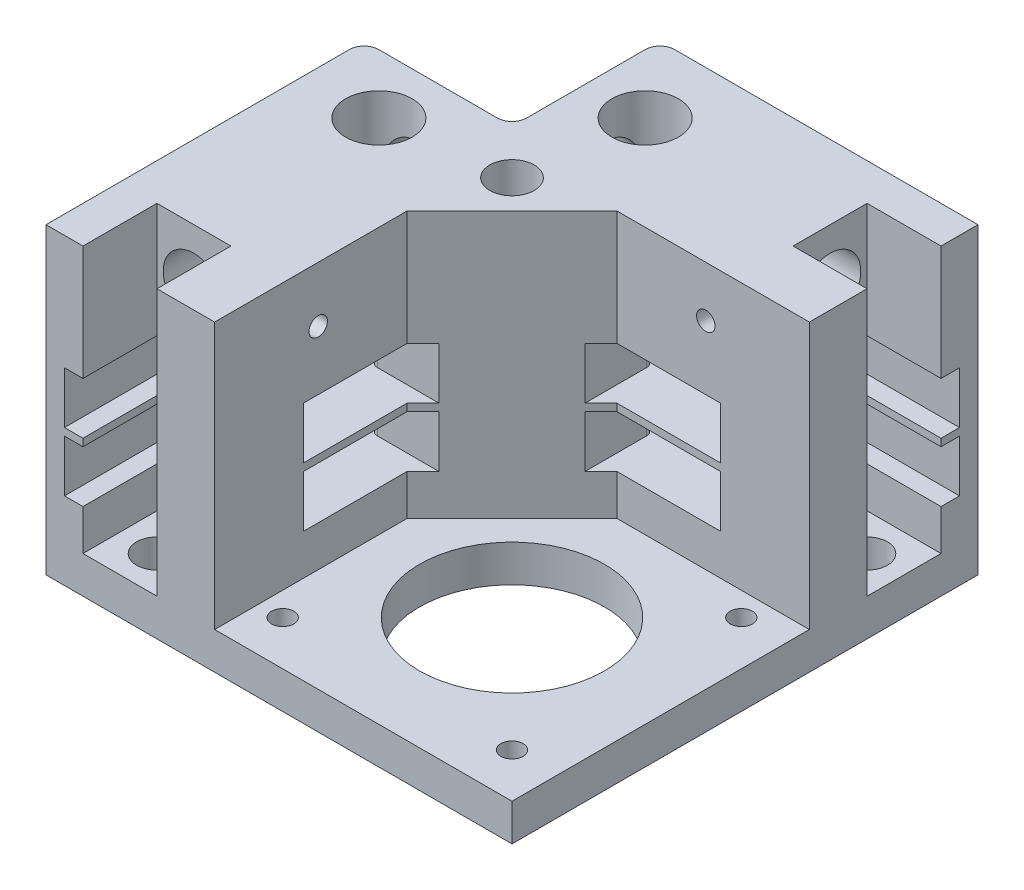
from build123d import *
from build123d.topology import SkipClean

# Parameters (mm, degrees)
SKETCH_1_R           = 1.5
SKETCH_1_R_2         = 12.5
EXTRUDE_1_DEPTH      = 5
EXTRUDE_2_DEPTH      = 36
SKETCH_4_R           = 4.15
CUT_EXTRUDE_2_DEPTH  = 36
SKETCH_6_R           = 1.5
CUT_EXTRUDE_4_DEPTH  = 7.5
SKETCH_7_R           = 3
CUT_EXTRUDE_5_DEPTH  = 69.851289022
SKETCH_8_R           = 4.15
CUT_EXTRUDE_6_DEPTH  = 36
EXTRUDE_3_DEPTH      = 0.5
CUT_EXTRUDE_START    = -28
SKETCH_10_R          = 1.5
CUT_EXTRUDE_7_DEPTH  = 28
EXTRUDE_START        = -5
SKETCH_11_R          = 4.15
SKETCH_11_R_2        = 2.5
EXTRUDE_4_DEPTH      = 5
SKETCH_12_R          = 4.15
SKETCH_12_R_2        = 2.5
EXTRUDE_5_DEPTH      = 5
CUT_EXTRUDE_8_REACH  = 73.593
SKETCH_13_R          = 4.5
SKETCH_13_W          = 10
SKETCH_13_H          = 10
SKETCH_14_R          = 2.75
CUT_EXTRUDE_9_DEPTH  = 5
SKETCH_15_R          = 1.25
CUT_EXTRUDE_10_DEPTH = 10
SKETCH_16_R          = 1.25
CUT_EXTRUDE_11_DEPTH = 10
FILLET_1_R           = 2
FILLET_2_R           = 1
FILLET_3_R           = 10
SKETCH_17_R          = 2.75
CUT_EXTRUDE_12_DEPTH = 10
SKETCH_18_R          = 2.75
CUT_EXTRUDE_13_DEPTH = 10


with BuildPart() as part:
    # 草图1 → 凸台-拉伸1 (new body)
    with BuildSketch(Plane(origin=(0, 0, 0), x_dir=(1, 0, 0), z_dir=(0, 1, 0))):
        Polygon((-21.5, 21.5), (-21.5, 41.5), (21.5, 41.5), (21.5, -21.5), (-41.5, -21.5), (-41.5, 21.5), align=None)
        with Locations(Location((-15.5, 15.5, 0), (0, 0, 270))):
            Circle(SKETCH_1_R, mode=Mode.SUBTRACT)
        with Locations(Location((15.5, 15.5, 0), (0, 0, 90))):
            Circle(SKETCH_1_R, mode=Mode.SUBTRACT)
        with Locations(Location((15.5, -15.5, 0), (0, 0, 270))):
            Circle(SKETCH_1_R, mode=Mode.SUBTRACT)
        with Locations(Location((-15.5, -15.5, 0), (0, 0, 90))):
            Circle(SKETCH_1_R, mode=Mode.SUBTRACT)
        with Locations(Location((0, 0, 0), (0, 0, 270))):
            Circle(SKETCH_1_R_2, mode=Mode.SUBTRACT)
    extrude(amount=EXTRUDE_1_DEPTH)

    # 草图2 → 凸台-拉伸2 (add)
    with BuildSketch(Plane(origin=(0, 5, 0), x_dir=(1, 0, 0), z_dir=(0, 1, 0))):
        Polygon((-21.5, 21.5), (-41.5, 21.5), (-41.5, -21.5), (21.5, -21.5), (21.5, 41.5), (-21.5, 41.5), align=None)
    extrude(amount=EXTRUDE_2_DEPTH)

    # 草图4 → 切除-拉伸2 (cut)
    with BuildSketch(Plane(origin=(21.5, 0, 0), x_dir=(0, 0, -1), z_dir=(1, 0, 0))):
        with Locations((31.5, 33.5)):
            Circle(SKETCH_4_R)
    extrude(amount=-CUT_EXTRUDE_2_DEPTH, mode=Mode.SUBTRACT)

    # 草图6 → 切除-拉伸4 (cut, symmetric)
    with BuildSketch(Plane(origin=(0, 18, 0), x_dir=(-1, 0, 0), z_dir=(0, -1, 0))):
        Polygon((20.439339828, 20.439339828), (39, 6.671746032), (39, -21.5), (31.5, -21.5), (31.5, -9.5), (24.5, -9.5), (-9.5, -9.5), (-9.5, 24.5), (-9.5, 31.5), (-21.5, 31.5), (-21.5, 39), (6.671746032, 39), align=None)
        with Locations(Location((31.5, -1.227922061, 0), (0, 0, 90))):
            Circle(SKETCH_6_R, mode=Mode.SUBTRACT)
        with Locations(Location((-1.227922061, 31.5, 0), (0, 0, 90))):
            Circle(SKETCH_6_R, mode=Mode.SUBTRACT)
        Polygon((27.294072413, 6.671746032), (6.671746032, 6.671746032), (6.671746032, 27.294072413), align=None, mode=Mode.SUBTRACT)
    extrude(amount=CUT_EXTRUDE_4_DEPTH, both=True, mode=Mode.SUBTRACT)

    # 草图7 → 切除-拉伸5 (cut, through all)
    with BuildSketch(Plane(origin=(0, 5, 0), x_dir=(-1, 0, 0), z_dir=(0, -1, 0))):
        with Locations(Location((15.5, 15.5, 0), (0, 0, 90))):
            Circle(SKETCH_7_R)
        Polygon((18.701010127, -21.5), (18.701010127, 4.5), (4.5, 18.701010127), (-21.5, 18.701010127), (-21.5, -21.5), align=None)
    extrude(amount=-CUT_EXTRUDE_5_DEPTH, mode=Mode.SUBTRACT)

    # 草图8 → 切除-拉伸6 (cut)
    with BuildSketch(Plane.XY.offset(21.5)):
        with Locations((-31.5, 33.5)):
            Circle(SKETCH_8_R)
    extrude(amount=-CUT_EXTRUDE_6_DEPTH, mode=Mode.SUBTRACT)

    # 草图9 → 凸台-拉伸3 (add, symmetric)
    with SkipClean():  # the faces are left unmerged after this step: merging them gives an invalid solid
        with BuildSketch(Plane(origin=(0, 18, 0), x_dir=(-1, 0, 0), z_dir=(0, -1, 0))):
            with BuildLine():
                Line((18.499807452, 15.466010994), (27.294072413, 6.671746032))
                Line((27.294072413, 6.671746032), (16.529264094, 6.671746032))
                Line((16.529264094, 6.671746032), (18.701010127, 4.5))
                Line((18.701010127, 4.5), (18.701010127, -9.5))
                Line((18.701010127, -9.5), (31.5, -9.5))
                Line((31.5, -9.5), (31.5, -21.5))
                Line((31.5, -21.5), (39, -21.5))
                Line((39, -21.5), (39, 6.671746032))
                Line((39, 6.671746032), (20.439339828, 20.439339828))
                Line((20.439339828, 20.439339828), (6.671746032, 39))
                Line((6.671746032, 39), (-21.5, 39))
                Line((-21.5, 39), (-21.5, 31.5))
                Line((-21.5, 31.5), (-9.5, 31.5))
                Line((-9.5, 31.5), (-9.5, 18.701010127))
                Line((-9.5, 18.701010127), (4.5, 18.701010127))
                Line((4.5, 18.701010127), (6.671746032, 16.529264094))
                Line((6.671746032, 16.529264094), (6.671746032, 27.294072413))
                Line((6.671746032, 27.294072413), (15.466010994, 18.499807452))
                ThreePointArc((15.466010994, 18.499807452), (17.621320344, 17.621320344), (18.499807452, 15.466010994))
            make_face()
        extrude(amount=EXTRUDE_3_DEPTH, both=True)

    # 草图10 → 切除-拉伸7 (cut)
    with SkipClean():  # the faces are left unmerged after this step: merging them gives an invalid solid
        with BuildSketch(Plane.XZ.offset(CUT_EXTRUDE_START)):
            with Locations(Location((1.227922061, -31.5, 0), (0, 0, 270))):
                Circle(SKETCH_10_R)
            with Locations(Location((-31.5, 1.227922061, 0), (0, 0, 270))):
                Circle(SKETCH_10_R)
        extrude(amount=CUT_EXTRUDE_7_DEPTH, mode=Mode.SUBTRACT)

    # 草图11 → 凸台-拉伸4 (add)
    with SkipClean():  # the faces are left unmerged after this step: merging them gives an invalid solid
        with BuildSketch(Plane.ZY.offset(21.5).offset(EXTRUDE_START)):
            with Locations(Location((-31.5, 33.5, 0), (0, 0, 180))):
                Circle(SKETCH_11_R)
            with Locations((-31.5, 33.5)):
                Circle(SKETCH_11_R_2, mode=Mode.SUBTRACT)
        extrude(amount=EXTRUDE_4_DEPTH)

    # 草图12 → 凸台-拉伸5 (add)
    with SkipClean():  # the faces are left unmerged after this step: merging them gives an invalid solid
        with BuildSketch(Plane(origin=(0, 0, -21.5), x_dir=(-1, 0, 0), z_dir=(0, 0, -1)).offset(EXTRUDE_START)):
            with Locations(Location((31.5, 33.5, 0), (0, 0, 180))):
                Circle(SKETCH_12_R)
            with Locations((31.5, 33.5)):
                Circle(SKETCH_12_R_2, mode=Mode.SUBTRACT)
        extrude(amount=EXTRUDE_5_DEPTH)

    # 切除-拉伸8: up to this face of the body (flat: up to its plane)
    cut_extrude_8_end = Plane(part.part.faces().sort_by_distance((-18.132481989, 5, 8.5))[0])
    # 草图13 → 切除-拉伸8 (cut, up to the picked face)
    with BuildSketch(Plane(origin=(0, 41, 0), x_dir=(1, 0, 0), z_dir=(0, 1, 0)), mode=Mode.PRIVATE) as cut_extrude_8_sk1:
        with Locations(Location((-31.5, 13.5, 0), (0, 0, 270))):
            Circle(SKETCH_13_R)
    cut_extrude_8_tool1 = split(extrude(cut_extrude_8_sk1.sketch, amount=-CUT_EXTRUDE_8_REACH, mode=Mode.PRIVATE), bisect_by=cut_extrude_8_end, keep=Keep.BOTH, mode=Mode.PRIVATE)
    # 草图13 → 切除-拉伸8 (cut, up to the picked face)
    with BuildSketch(Plane(origin=(0, 41, 0), x_dir=(1, 0, 0), z_dir=(0, 1, 0)), mode=Mode.PRIVATE) as cut_extrude_8_sk2:
        with Locations(Location((-13.5, 31.5, 0), (0, 0, 90))):
            Circle(SKETCH_13_R)
    cut_extrude_8_tool2 = split(extrude(cut_extrude_8_sk2.sketch, amount=-CUT_EXTRUDE_8_REACH, mode=Mode.PRIVATE), bisect_by=cut_extrude_8_end, keep=Keep.BOTH, mode=Mode.PRIVATE)
    # 草图13 → 切除-拉伸8 (cut, up to the picked face)
    with BuildSketch(Plane(origin=(0, 41, 0), x_dir=(1, 0, 0), z_dir=(0, 1, 0)), mode=Mode.PRIVATE) as cut_extrude_8_sk3:
        with Locations((-31.5, -16.5)):
            Rectangle(SKETCH_13_W, SKETCH_13_H)
    cut_extrude_8_tool3 = split(extrude(cut_extrude_8_sk3.sketch, amount=-CUT_EXTRUDE_8_REACH, mode=Mode.PRIVATE), bisect_by=cut_extrude_8_end, keep=Keep.BOTH, mode=Mode.PRIVATE)
    # 草图13 → 切除-拉伸8 (cut, up to the picked face)
    with BuildSketch(Plane(origin=(0, 41, 0), x_dir=(1, 0, 0), z_dir=(0, 1, 0)), mode=Mode.PRIVATE) as cut_extrude_8_sk4:
        with Locations((16.5, 31.5)):
            Rectangle(SKETCH_13_W, SKETCH_13_H)
    cut_extrude_8_tool4 = split(extrude(cut_extrude_8_sk4.sketch, amount=-CUT_EXTRUDE_8_REACH, mode=Mode.PRIVATE), bisect_by=cut_extrude_8_end, keep=Keep.BOTH, mode=Mode.PRIVATE)
    add(cut_extrude_8_tool1.solids().sort_by(Axis((-31.5, 41, -13.5), (0, -1, 0)))[0], mode=Mode.SUBTRACT)
    add(cut_extrude_8_tool2.solids().sort_by(Axis((-13.5, 41, -31.5), (0, -1, 0)))[0], mode=Mode.SUBTRACT)
    add(cut_extrude_8_tool3.solids().sort_by(Axis((-31.5, 41, 16.5), (0, -1, 0)))[0], mode=Mode.SUBTRACT)
    add(cut_extrude_8_tool4.solids().sort_by(Axis((16.5, 41, -31.5), (0, -1, 0)))[0], mode=Mode.SUBTRACT)

    # 草图14 → 切除-拉伸9 (cut)
    with SkipClean():  # the faces are left unmerged after this step: merging them gives an invalid solid
        with BuildSketch(Plane(origin=(0, 5, 0), x_dir=(1, 0, 0), z_dir=(0, 1, 0))):
            with Locations(Location((-31.5, -16.5, 0), (0, 0, 270))):
                Circle(SKETCH_14_R)
            with Locations(Location((16.5, 31.5, 0), (0, 0, 270))):
                Circle(SKETCH_14_R)
            with Locations(Location((-31.5, 13.5, 0), (0, 0, 270))):
                Circle(SKETCH_14_R)
            with Locations(Location((-13.5, 31.5, 0), (0, 0, 270))):
                Circle(SKETCH_14_R)
        extrude(amount=-CUT_EXTRUDE_9_DEPTH, mode=Mode.SUBTRACT)

    # 草图15 → 切除-拉伸10 (cut)
    with SkipClean():  # the faces are left unmerged after this step: merging them gives an invalid solid
        with BuildSketch(Plane.XY.offset(-18.701010127)):
            with Locations((7.5, 34.146573049)):
                Circle(SKETCH_15_R)
        extrude(amount=-CUT_EXTRUDE_10_DEPTH, mode=Mode.SUBTRACT)

    # 草图16 → 切除-拉伸11 (cut)
    with SkipClean():  # the faces are left unmerged after this step: merging them gives an invalid solid
        with BuildSketch(Plane(origin=(-18.701010127, 0, 0), x_dir=(0, 0, -1), z_dir=(1, 0, 0))):
            with Locations((-7.5, 33.5)):
                Circle(SKETCH_16_R)
        extrude(amount=-CUT_EXTRUDE_11_DEPTH, mode=Mode.SUBTRACT)

    # 圆角1
    fillet_1_edges = [part.edges().sort_by_distance(p)[0] for p in [
        (-21.5, 20.5, -21.5),
        (-21.5, 20.5, -41.5),
        (-41.5, 20.5, -21.5),
    ]]
    fillet(fillet_1_edges, radius=FILLET_1_R)

    # 圆角2
    fillet_2_edges = [part.edges().sort_by_distance(p)[0] for p in [
        (-18.499807452, 14, -15.466010994),
        (-15.466010994, 22, -18.499807452),
        (-15.466010994, 14, -18.499807452),
        (-18.499807452, 22, -15.466010994),
        (-6.671746032, 14, -27.294072413),
        (-27.294072413, 14, -6.671746032),
        (-10.072279215, 14, -34.415601176),
        (-15.295635311, 14, -27.373779716),
        (-10.072279215, 22, -34.415601176),
        (-15.295635311, 22, -27.373779716),
        (-27.373779716, 14, -15.295635311),
        (-34.415601176, 14, -10.072279215),
        (-27.373779716, 22, -15.295635311),
        (-34.415601176, 22, -10.072279215),
        (-27.294072413, 22, -6.671746032),
        (-6.671746032, 22, -27.294072413),
    ]]
    fillet(fillet_2_edges, radius=FILLET_2_R)

    # 圆角3
    fillet_3_edges = [part.edges().sort_by_distance(p)[0] for p in [
        (-39, 14, -6.671746032),
        (-6.671746032, 14, -39),
        (-6.671746032, 22, -39),
        (-39, 22, -6.671746032),
        (-20.439339828, 22, -20.439339828),
        (-20.439339828, 14, -20.439339828),
    ]]
    fillet(fillet_3_edges, radius=FILLET_3_R)

    # 草图17 → 切除-拉伸12 (cut)
    with SkipClean():  # the faces are left unmerged after this step: merging them gives an invalid solid
        with BuildSketch(Plane.ZY.offset(21.5)):
            with Locations((-31.5, 33.5)):
                Circle(SKETCH_17_R)
        extrude(amount=-CUT_EXTRUDE_12_DEPTH, mode=Mode.SUBTRACT)

    # 草图18 → 切除-拉伸13 (cut)
    with SkipClean():  # the faces are left unmerged after this step: merging them gives an invalid solid
        with BuildSketch(Plane(origin=(0, 0, -21.5), x_dir=(-1, 0, 0), z_dir=(0, 0, -1))):
            with Locations((31.5, 33.5)):
                Circle(SKETCH_18_R)
        extrude(amount=-CUT_EXTRUDE_13_DEPTH, mode=Mode.SUBTRACT)


solid = part.part
